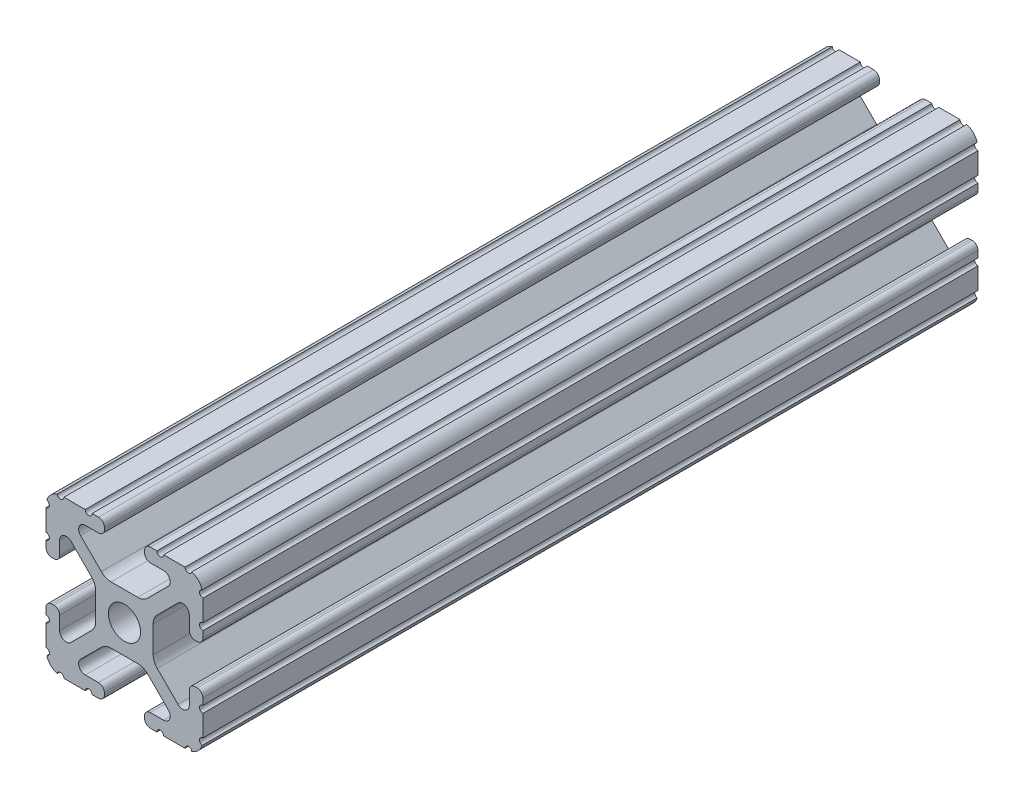
from build123d import *

# Parameters (mm, degrees)
BOSS_EXTRUDE1_DEPTH     = 76.2
CUT_EXTRUDE1_DEPTH      = 79.288057838
CUT_EXTRUDE1_DEPTH_BACK = 79.288057838
SKETCH5_R               = 0.55245
SKETCH6_W               = 30.48
SKETCH6_H               = 30.48
CUT_EXTRUDE2_DEPTH      = 26.924


with BuildPart() as part:
    # Sketch4 → Boss-Extrude1 (new, symmetric)
    with BuildSketch(Plane.XY):
        with BuildLine():
            Line((4.190365, -12.7), (10.11729625, -12.7))
            ThreePointArc((10.11729625, -12.7), (11.943543585, -11.943543585), (12.7, -10.11729625))
            Line((12.7, -10.11729625), (12.7, -4.190365))
            ThreePointArc((12.7, -4.190365), (12.42492494, -3.52627506), (11.760835, -3.2512))
            Line((11.760835, -3.2512), (11.429365, -3.2512))
            ThreePointArc((11.429365, -3.2512), (10.76527506, -3.52627506), (10.4902, -4.190365))
            Line((10.4902, -4.190365), (10.4902, -6.348478019))
            ThreePointArc((10.4902, -6.348478019), (9.830707141, -7.335478831), (8.666460301, -7.103895736))
            Line((8.666460301, -7.103895736), (5.299899128, -3.737334563))
            ThreePointArc((5.299899128, -3.737334563), (4.817571085, -3.015479634), (4.6482, -2.16399369))
            Line((4.6482, -2.16399369), (4.6482, 0))
            Line((4.6482, 0), (2.6035, 0))
            ThreePointArc((2.6035, 0), (1.840952505, -1.840952505), (0, -2.6035))
            Line((0, -2.6035), (0, -4.6482))
            Line((0, -4.6482), (2.16399369, -4.6482))
            ThreePointArc((2.16399369, -4.6482), (3.015479634, -4.817571085), (3.737334563, -5.299899128))
            Line((3.737334563, -5.299899128), (7.103895736, -8.666460301))
            ThreePointArc((7.103895736, -8.666460301), (7.335478831, -9.830707141), (6.348478019, -10.4902))
            Line((6.348478019, -10.4902), (4.190365, -10.4902))
            ThreePointArc((4.190365, -10.4902), (3.52627506, -10.76527506), (3.2512, -11.429365))
            Line((3.2512, -11.429365), (3.2512, -11.760835))
            ThreePointArc((3.2512, -11.760835), (3.52627506, -12.42492494), (4.190365, -12.7))
        make_face()
    extrude(amount=BOSS_EXTRUDE1_DEPTH, both=True)

    # Sketch5 → Cut-Extrude1 (cut, two sides: drawn at the far end of the back side and taken through both)
    with BuildSketch(Plane.XY.offset(-CUT_EXTRUDE1_DEPTH_BACK)):
        with Locations((10.356153152, -12.7)):
            Circle(SKETCH5_R)
        with Locations((5.796028019, -12.7)):
            Circle(SKETCH5_R)
        with Locations((12.7, -10.356153152)):
            Circle(SKETCH5_R)
        with Locations((12.7, -5.796028019)):
            Circle(SKETCH5_R)
    extrude(amount=CUT_EXTRUDE1_DEPTH + CUT_EXTRUDE1_DEPTH_BACK, mode=Mode.SUBTRACT)

    # Mirror1: part across plane


with BuildPart() as part_1:
    add(part.part)
    add(part.part.mirror(Plane(origin=(0, 0, 0), x_dir=(0, 0, 1), z_dir=(1, 0, 0))))

    # Mirror2: part across plane


with BuildPart() as part_2:
    add(part_1.part)
    add(part_1.part.mirror(Plane.ZX))

    # Sketch6 → Cut-Extrude2 (cut)
    with BuildSketch(Plane.XY.offset(76.2)):
        Rectangle(SKETCH6_W, SKETCH6_H)
    extrude(amount=-CUT_EXTRUDE2_DEPTH, mode=Mode.SUBTRACT)


solid = part_2.part
